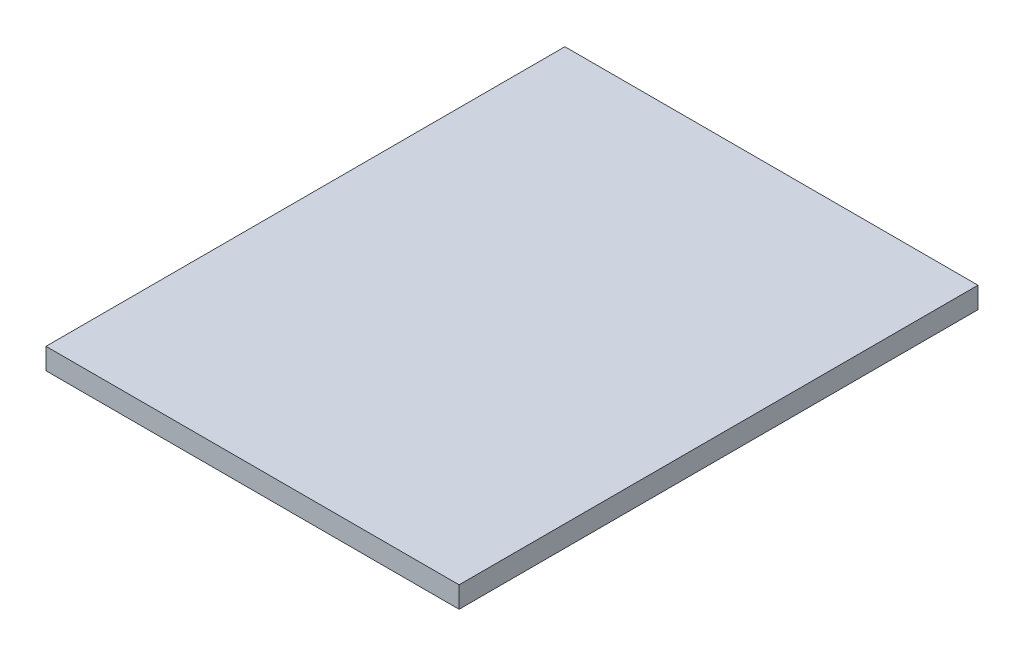
from build123d import *

# Parameters (mm, degrees)
CROQUIS1_W              = 370
CROQUIS1_H              = 464.78
SALIENTE_EXTRUIR1_DEPTH = 19


with BuildPart() as part:
    # Croquis1 → Saliente-Extruir1 (new body)
    with BuildSketch(Plane(origin=(0, 0, 0), x_dir=(1, 0, 0), z_dir=(0, 1, 0))):
        with Locations((50.262089332, -68.973333333)):
            Rectangle(CROQUIS1_W, CROQUIS1_H)
    extrude(amount=SALIENTE_EXTRUIR1_DEPTH)


solid = part.part
